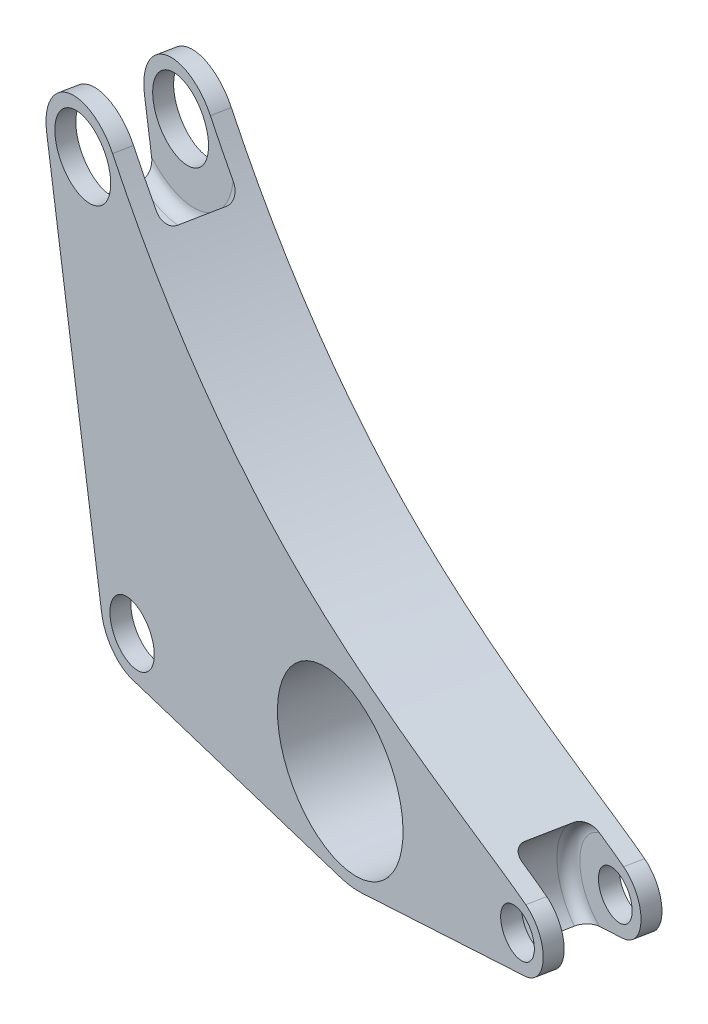
from build123d import *

# Parameters (mm, degrees)
SKETCH1_R           = 8.89
SKETCH1_R_2         = 6.35
SKETCH1_R_3         = 20.5232
SKETCH1_R_4         = 17.9832
SKETCH1_R_5         = 7.366
SKETCH1_R_6         = 4.826
SKETCH1_R_7         = 10.541
SKETCH1_R_8         = 8.001
BOSS_EXTRUDE2_DEPTH = 21.59
CUT_EXTRUDE1_START  = -3.81
SKETCH2_R           = 17.78
CUT_EXTRUDE1_DEPTH  = 13.97
FILLET1_R           = 2.54
FILLET2_R           = 2.54
CUT_EXTRUDE2_START  = -3.81
SKETCH3_R           = 15.24
CUT_EXTRUDE2_DEPTH  = 13.97
CUT_EXTRUDE3_START  = -3.81
SKETCH4_R           = 12.7
CUT_EXTRUDE3_DEPTH  = 13.97
FILLET3_R           = 2.54
FILLET4_R           = 2.54
FILLET5_R           = 2.54
FILLET6_R           = 2.54


with BuildPart() as part:
    # Sketch1 → Boss-Extrude2 (new body)
    # profile 1 of 5: a face of its own
    with BuildSketch(Plane(origin=(137.022928704, 13.910957229, -612.082118069), x_dir=(0.9758586903355311, -0.004962420289006407, 0.2183464927162727), z_dir=(-0.21840287657588692, -0.022172880870649295, 0.9756067583085278))):
        with Locations((-515.904419018, 83.525886776)):
            Circle(SKETCH1_R)
        with Locations(Location((-515.904419018, 83.525886776, 0), (0, 0, 0.284396825))):
            Circle(SKETCH1_R_2, mode=Mode.SUBTRACT)
    # profile 2 of 5: a face of its own
    with BuildSketch(Plane(origin=(137.022928704, 13.910957229, -612.082118069), x_dir=(0.9758586903355311, -0.004962420289006407, 0.2183464927162727), z_dir=(-0.21840287657588692, -0.022172880870649295, 0.9756067583085278))):
        with BuildLine():
            ThreePointArc((-516.984737477, 167.088862578), (-526.695142738, 156.580637544), (-537.935841429, 165.43283821))
            Line((-537.935841429, 165.43283821), (-524.684024761, 82.129239718))
            ThreePointArc((-524.684024761, 82.129239718), (-516.604920606, 92.388245239), (-507.014419018, 83.525886776))
            ThreePointArc((-507.014419018, 83.525886776), (-509.688789091, 77.169941165), (-516.102843003, 74.638101454))
            Line((-516.102843003, 74.638101454), (-456.412870502, 73.305494765))
            ThreePointArc((-456.412870502, 73.305494765), (-470.304020221, 108.496736461), (-435.431594561, 93.823582022))
            ThreePointArc((-435.431594561, 93.823582022), (-439.640521691, 81.37182556), (-450.540957524, 74.027317052))
            Line((-450.540957524, 74.027317052), (-403.212335288, 86.970639863))
            ThreePointArc((-403.212335288, 86.970639863), (-412.513743727, 94.411939173), (-402.572515518, 100.9740361))
            add(Edge.make_bspline(
                [(-518.810973065, 173.018918416), (-506.208868592, 154.498962689), (-469.220893397, 117.541484506), (-414.70453676, 105.516583), (-402.572515518, 100.9740361)],
                knots=[0, 0, 0, 0, 0.448047666, 1, 1, 1, 1], degree=3))
            ThreePointArc((-518.810973065, 173.018918416), (-517.451636707, 170.19130914), (-516.984737477, 167.088862578))
        make_face()
    # profile 3 of 5: a face of its own
    with BuildSketch(Plane(origin=(137.022928704, 13.910957229, -612.082118069), x_dir=(0.9758586903355311, -0.004962420289006407, 0.2183464927162727), z_dir=(-0.21840287657588692, -0.022172880870649295, 0.9756067583085278))):
        with Locations((-455.954794561, 93.823582022)):
            Circle(SKETCH1_R_3)
        with Locations(Location((-455.954794561, 93.823582022, 0), (0, 0, 0.284396825))):
            Circle(SKETCH1_R_4, mode=Mode.SUBTRACT)
    # profile 4 of 5: a face of its own
    with BuildSketch(Plane(origin=(137.022928704, 13.910957229, -612.082118069), x_dir=(0.9758586903355311, -0.004962420289006407, 0.2183464927162727), z_dir=(-0.21840287657588692, -0.022172880870649295, 0.9756067583085278))):
        with Locations((-405.155420363, 94.075734964)):
            Circle(SKETCH1_R_5)
        with Locations(Location((-405.155420363, 94.075734964, 0), (0, 0, 0.284396825))):
            Circle(SKETCH1_R_6, mode=Mode.SUBTRACT)
    # profile 5 of 5: a face of its own
    with BuildSketch(Plane(origin=(137.022928704, 13.910957229, -612.082118069), x_dir=(0.9758586903355311, -0.004962420289006407, 0.2183464927162727), z_dir=(-0.21840287657588692, -0.022172880870649295, 0.9756067583085278))):
        with Locations((-527.525737477, 167.088862578)):
            Circle(SKETCH1_R_7)
        with Locations(Location((-527.525737477, 167.088862578, 0), (0, 0, 0.284396825))):
            Circle(SKETCH1_R_8, mode=Mode.SUBTRACT)
    extrude(amount=BOSS_EXTRUDE2_DEPTH)

    # Sketch2 → Cut-Extrude1 (cut)
    with BuildSketch(Plane(origin=(132.307610599, 13.432244731, -591.018768157), x_dir=(0.9758586903355311, -0.004962420289006333, 0.21834649271627268), z_dir=(-0.21840287657588686, -0.02217288087064896, 0.9756067583085277)).offset(CUT_EXTRUDE1_START)):
        with Locations((-527.525737477, 167.088862578)):
            Circle(SKETCH2_R)
    extrude(amount=-CUT_EXTRUDE1_DEPTH, mode=Mode.SUBTRACT)

    # Fillet1
    fillet1_edges = [part.edges().sort_by_distance(p)[0] for p in [
        (-374.929482634, 166.758577909, -704.991280956),
    ]]
    fillet(fillet1_edges, radius=FILLET1_R)

    # Fillet2
    fillet2_edges = [part.edges().sort_by_distance(p)[0] for p in [
        (-371.878394448, 167.068333055, -718.62050737),
    ]]
    fillet(fillet2_edges, radius=FILLET2_R)

    # Sketch3 → Cut-Extrude2 (cut)
    with BuildSketch(Plane(origin=(132.307610599, 13.432244731, -591.018768157), x_dir=(0.9758586903355311, -0.004962420289006349, 0.21834649271627266), z_dir=(-0.21840287657588686, -0.022172880870649038, 0.9756067583085278)).offset(CUT_EXTRUDE2_START)):
        with Locations((-515.904419018, 83.525886776)):
            Circle(SKETCH3_R)
    extrude(amount=-CUT_EXTRUDE2_DEPTH, mode=Mode.SUBTRACT)

    # Sketch4 → Cut-Extrude3 (cut)
    with BuildSketch(Plane(origin=(132.307610599, 13.432244731, -591.018768157), x_dir=(0.9758586903355311, -0.004962420289006349, 0.21834649271627266), z_dir=(-0.21840287657588683, -0.02217288087064903, 0.9756067583085277)).offset(CUT_EXTRUDE3_START)):
        with Locations((-405.155420363, 94.075734964)):
            Circle(SKETCH4_R)
    extrude(amount=-CUT_EXTRUDE3_DEPTH, mode=Mode.SUBTRACT)

    # Fillet3
    fillet3_edges = [part.edges().sort_by_distance(p)[0] for p in [
        (-360.529617581, 111.009277127, -703.034704365),
    ]]
    fillet(fillet3_edges, radius=FILLET3_R)

    # Fillet4
    fillet4_edges = [part.edges().sort_by_distance(p)[0] for p in [
        (-357.478529395, 111.319032273, -716.663930779),
    ]]
    fillet(fillet4_edges, radius=FILLET4_R)

    # Fillet5
    fillet5_edges = [part.edges().sort_by_distance(p)[0] for p in [
        (-271.573716462, 110.245043822, -697.457375803),
    ]]
    fillet(fillet5_edges, radius=FILLET5_R)

    # Fillet6
    fillet6_edges = [part.edges().sort_by_distance(p)[0] for p in [
        (-274.624804647, 109.935288677, -683.828149389),
    ]]
    fillet(fillet6_edges, radius=FILLET6_R)


solid = part.part
